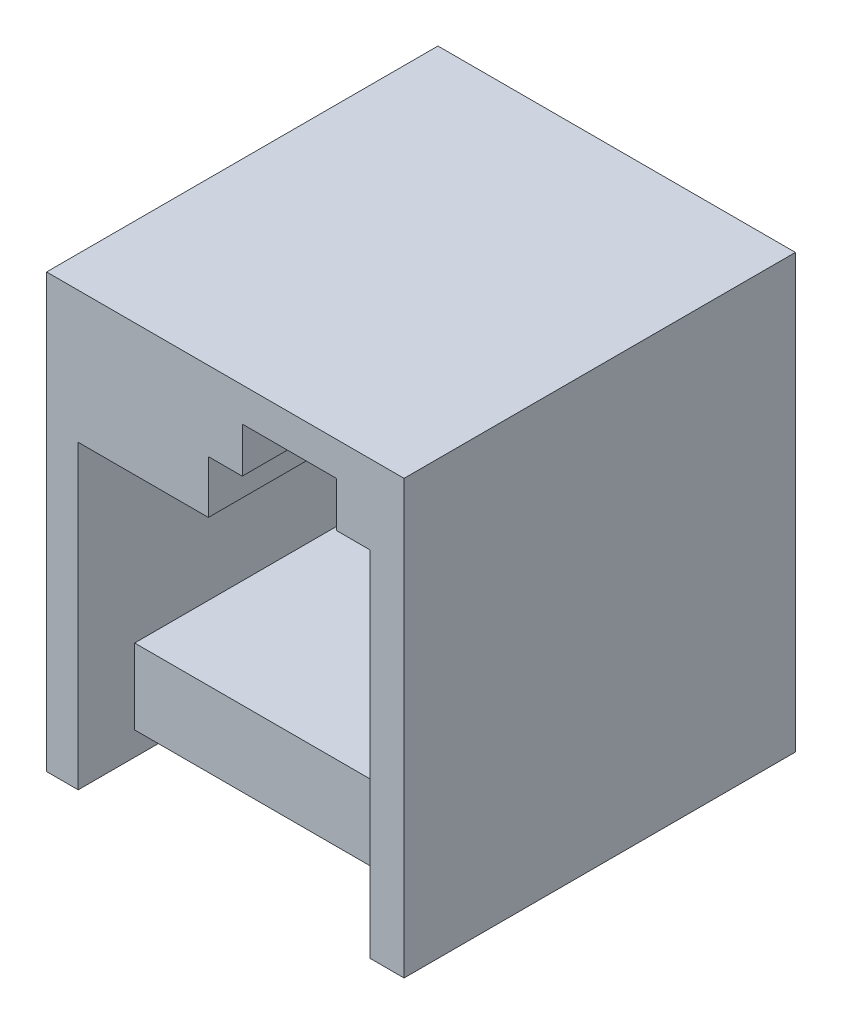
from build123d import *

# Parameters (mm, degrees)
EXTRUDE1_DEPTH = 2.032
SKETCH2_W      = 9.8552
SKETCH2_H      = 2.54
EXTRUDE3_DEPTH = 11.303
SKETCH3_W      = 9.8552
SKETCH3_H      = 2.54
EXTRUDE4_DEPTH = 1.905
SKETCH4_W      = 12.065
SKETCH4_H      = 14.605
EXTRUDE5_DEPTH = 1.905


with BuildPart() as part:
    # Sketch1 → Extrude1 (new body)
    with BuildSketch(Plane.XY):
        Polygon((0, 0), (0, 14.605), (12.065, 14.605), (12.065, 0), (10.922, 0), (10.922, 11.938), (9.779, 11.938), (9.779, 13.462), (6.604, 13.462), (6.604, 11.938), (5.461, 11.938), (5.461, 10.16), (1.0668, 10.16), (1.0668, 0), align=None)
    extrude(amount=EXTRUDE1_DEPTH)

    # Sketch2 → Extrude3 (add)
    with BuildSketch(Plane.XY.offset(2.032)):
        Polygon((0, 14.605), (0, 0), (1.0668, 0), (1.0668, 10.16), (5.461, 10.16), (5.461, 11.938), (6.604, 11.938), (6.604, 13.462), (9.779, 13.462), (9.779, 11.938), (10.922, 11.938), (10.922, 0), (12.065, 0), (12.065, 14.605), align=None)
        with Locations((5.9944, 2.0701)):
            Rectangle(SKETCH2_W, SKETCH2_H)
    extrude(amount=-EXTRUDE3_DEPTH)

    # Sketch3 → Extrude4 (cut)
    with BuildSketch(Plane.XY.offset(2.032)):
        with Locations((5.9944, 2.0701)):
            Rectangle(SKETCH3_W, SKETCH3_H)
    extrude(amount=-EXTRUDE4_DEPTH, mode=Mode.SUBTRACT)

    # Sketch4 → Extrude5 (add)
    with BuildSketch(Plane(origin=(0, 0, -9.271), x_dir=(-1, 0, 0), z_dir=(0, 0, -1))):
        with Locations((-6.0325, 7.3025)):
            Rectangle(SKETCH4_W, SKETCH4_H)
    extrude(amount=EXTRUDE5_DEPTH)


solid = part.part
